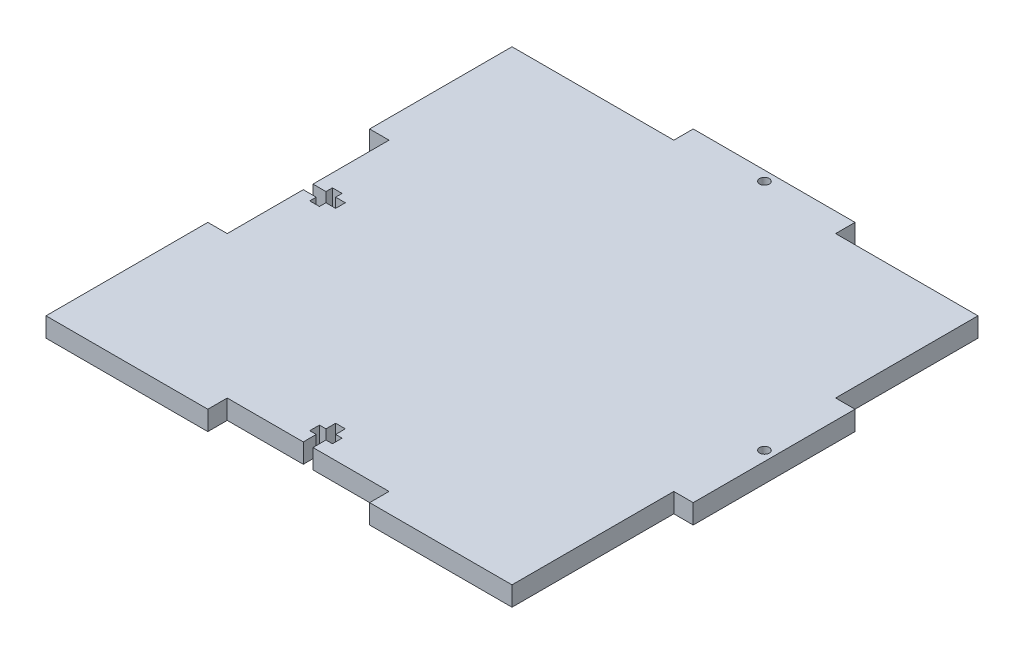
from build123d import *

# Parameters (mm, degrees)
SKETCH1_R           = 1.5
BOSS_EXTRUDE1_DEPTH = 6


with BuildPart() as part:
    # Sketch1 → Boss-Extrude1 (new body)
    with BuildSketch(Plane(origin=(0, 0, 0), x_dir=(1, 0, 0), z_dir=(0, 1, 0))):
        Polygon((-72, 72), (-72, 28), (-66, 28), (-66, 4.5), (-62, 4.5), (-62, 6.5), (-59, 6.5), (-59, 4.5), (-56, 4.5), (-56, 1.5), (-59, 1.5), (-59, -0.5), (-62, -0.5), (-62, 1.5), (-66, 1.5), (-66, -22), (-72, -22), (-72, -72), (-22, -72), (-22, -66), (1.5, -66), (1.5, -62), (-0.5, -62), (-0.5, -59), (1.5, -59), (1.5, -56), (4.5, -56), (4.5, -59), (6.5, -59), (6.5, -62), (4.5, -62), (4.5, -66), (28, -66), (28, -72), (72, -72), (72, -22), (78, -22), (78, 28), (72, 28), (72, 72), (28, 72), (28, 78), (-22, 78), (-22, 72), align=None)
        with Locations(Location((3, 75, 0), (0, 0, 270))):
            Circle(SKETCH1_R, mode=Mode.SUBTRACT)
        with Locations(Location((75, 3, 0), (0, 0, 270))):
            Circle(SKETCH1_R, mode=Mode.SUBTRACT)
    extrude(amount=BOSS_EXTRUDE1_DEPTH)


solid = part.part
